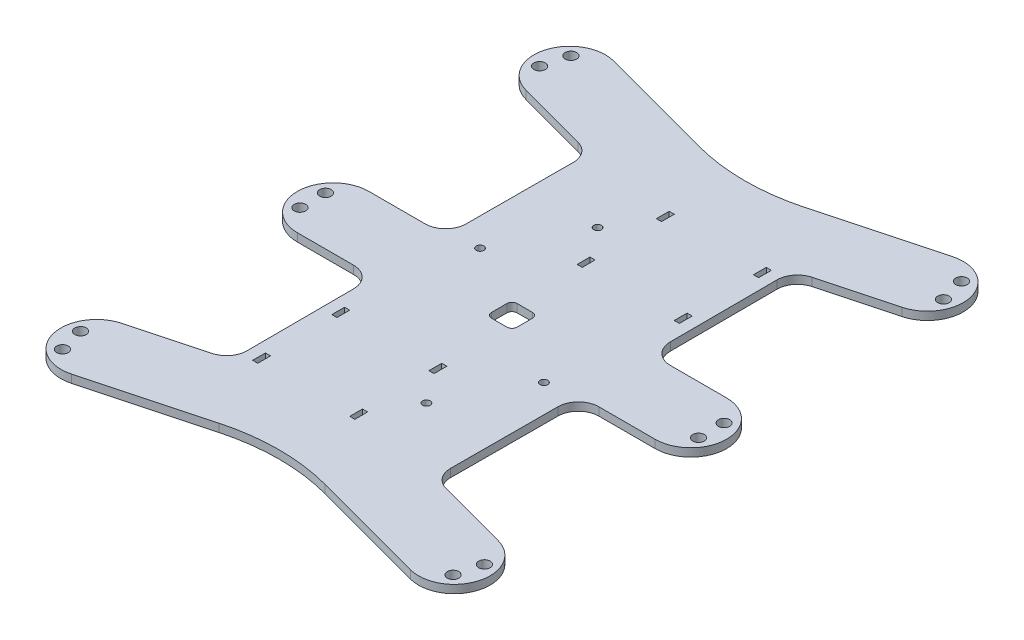
from build123d import *

# Parameters (mm, degrees)
BOSS_EXTRUDE1_DEPTH = 3.175
FILLET1_R           = 80
FILLET2_R           = 8
SKETCH7_R           = 2.25
CUT_EXTRUDE4_DEPTH  = 10
CUT_EXTRUDE5_DEPTH  = 10
SKETCH9_W           = 10
SKETCH9_H           = 10
CUT_EXTRUDE6_DEPTH  = 10
FILLET3_R           = 2
SKETCH12_W          = 2
SKETCH12_H          = 5
CUT_EXTRUDE7_DEPTH  = 10


with BuildPart() as part:
    # Sketch1 → Boss-Extrude1 (new body)
    with BuildSketch(Plane(origin=(0, 0, 0), x_dir=(1, 0, 0), z_dir=(0, 1, 0))):
        with BuildLine():
            Line((-70, 14), (-40, 14))
            Line((-40, 14), (-39.816062711, 70))
            Line((-39.816062711, 70), (-73.623466631, 79.058666579))
            ThreePointArc((-73.623466631, 79.058666579), (-83.522961568, 96.205094778), (-66.376533369, 106.104589715))
            Line((-66.376533369, 106.104589715), (0, 88.319051202))
            Line((0, 88.319051202), (66.376533369, 106.104589715))
            ThreePointArc((66.376533369, 106.104589715), (83.522961568, 96.205094778), (73.623466631, 79.058666579))
            Line((73.623466631, 79.058666579), (39.816062711, 70))
            Line((39.816062711, 70), (40, 14))
            Line((40, 14), (70, 14))
            ThreePointArc((70, 14), (84, 0), (70, -14))
            Line((70, -14), (40, -14))
            Line((40, -14), (39.816062711, -70))
            Line((39.816062711, -70), (73.623466631, -79.058666579))
            ThreePointArc((73.623466631, -79.058666579), (83.522961568, -96.205094778), (66.376533369, -106.104589715))
            Line((66.376533369, -106.104589715), (0, -88.319051202))
            Line((0, -88.319051202), (-66.376533369, -106.104589715))
            ThreePointArc((-66.376533369, -106.104589715), (-83.522961568, -96.205094778), (-73.623466631, -79.058666579))
            Line((-73.623466631, -79.058666579), (-39.816062711, -70))
            Line((-39.816062711, -70), (-40, -14))
            Line((-40, -14), (-70, -14))
            ThreePointArc((-70, -14), (-84, 0), (-70, 14))
        make_face()
    extrude(amount=BOSS_EXTRUDE1_DEPTH)

    # Fillet1
    fillet1_edges = [part.edges().sort_by_distance(p)[0] for p in [
        (0, 1.5875, -88.319051202),
        (0, 1.5875, 88.319051202),
    ]]
    fillet(fillet1_edges, radius=FILLET1_R)

    # Fillet2
    fillet2_edges = [part.edges().sort_by_distance(p)[0] for p in [
        (-40, 1.5875, -14),
        (-39.816062711, 1.5875, -70),
        (39.816062711, 1.5875, -70),
        (40, 1.5875, -14),
        (40, 1.5875, 14),
        (39.816062711, 1.5875, 70),
        (-39.816062711, 1.5875, 70),
        (-40, 1.5875, 14),
    ]]
    fillet(fillet2_edges, radius=FILLET2_R)

    # Sketch7 → Cut-Extrude4 (cut)
    with BuildSketch(Plane(origin=(0, 3.175, 0), x_dir=(1, 0, 0), z_dir=(0, 1, 0))):
        with Locations(Location((-76.433311385, -99.481809639, 0), (0, 0, 270))):
            Circle(SKETCH7_R)
        with Locations(Location((-79.021501836, -89.822551376, 0), (0, 0, 270))):
            Circle(SKETCH7_R)
        with Locations(Location((-78, -5, 0), (0, 0, 270))):
            Circle(SKETCH7_R)
        with Locations(Location((-78, 5, 0), (0, 0, 270))):
            Circle(SKETCH7_R)
        with Locations(Location((-79.021501836, 89.822551376, 0), (0, 0, 270))):
            Circle(SKETCH7_R)
        with Locations(Location((-76.433311385, 99.481809639, 0), (0, 0, 270))):
            Circle(SKETCH7_R)
        with Locations(Location((79.021501836, 89.822551376, 0), (0, 0, 270))):
            Circle(SKETCH7_R)
        with Locations(Location((76.433311385, 99.481809639, 0), (0, 0, 270))):
            Circle(SKETCH7_R)
        with Locations(Location((78, -5, 0), (0, 0, 270))):
            Circle(SKETCH7_R)
        with Locations(Location((78, 5, 0), (0, 0, 270))):
            Circle(SKETCH7_R)
        with Locations(Location((79.021501836, -89.822551376, 0), (0, 0, 270))):
            Circle(SKETCH7_R)
        with Locations(Location((76.433311385, -99.481809639, 0), (0, 0, 270))):
            Circle(SKETCH7_R)
    extrude(amount=-CUT_EXTRUDE4_DEPTH, mode=Mode.SUBTRACT)

    # Sketch8 → Cut-Extrude5 (cut)
    with BuildSketch(Plane(origin=(0, 3.175, 0), x_dir=(1, 0, 0), z_dir=(0, 1, 0))):
        with BuildLine():
            ThreePointArc((13, -45), (11.5, -46.5), (13, -48))
            ThreePointArc((13, -48), (14.5, -46.5), (13, -45))
        make_face()
        with BuildLine():
            ThreePointArc((29, -15), (27.5, -16.5), (29, -18))
            ThreePointArc((29, -18), (30.5, -16.5), (29, -15))
        make_face()
        with BuildLine():
            ThreePointArc((-13, 48), (-14.5, 46.5), (-13, 45))
            ThreePointArc((-13, 45), (-11.5, 46.5), (-13, 48))
        make_face()
        with BuildLine():
            ThreePointArc((-29, 18), (-30.5, 16.5), (-29, 15))
            ThreePointArc((-29, 15), (-27.5, 16.5), (-29, 18))
        make_face()
    extrude(amount=-CUT_EXTRUDE5_DEPTH, mode=Mode.SUBTRACT)

    # Sketch9 → Cut-Extrude6 (cut)
    with BuildSketch(Plane(origin=(0, 3.175, 0), x_dir=(1, 0, 0), z_dir=(0, 1, 0))):
        Rectangle(SKETCH9_W, SKETCH9_H)
    extrude(amount=-CUT_EXTRUDE6_DEPTH, mode=Mode.SUBTRACT)

    # Fillet3
    fillet3_edges = [part.edges().sort_by_distance(p)[0] for p in [
        (-5, 1.5875, 5),
        (-5, 1.5875, -5),
        (5, 1.5875, -5),
        (5, 1.5875, 5),
    ]]
    fillet(fillet3_edges, radius=FILLET3_R)

    # Sketch12 → Cut-Extrude7 (cut)
    with BuildSketch(Plane(origin=(0, 3.175, 0), x_dir=(1, 0, 0), z_dir=(0, 1, 0))):
        with Locations((-34.5, -32.5)):
            Rectangle(SKETCH12_W, SKETCH12_H)
        with Locations((-34.5, -63.5)):
            Rectangle(SKETCH12_W, SKETCH12_H)
        with Locations((3.5, -63.5)):
            Rectangle(SKETCH12_W, SKETCH12_H)
        with Locations((3.5, -32.5)):
            Rectangle(SKETCH12_W, SKETCH12_H)
        with Locations((-3.5, 63.5)):
            Rectangle(SKETCH12_W, SKETCH12_H)
        with Locations((-3.5, 32.5)):
            Rectangle(SKETCH12_W, SKETCH12_H)
        with Locations((34.5, 32.5)):
            Rectangle(SKETCH12_W, SKETCH12_H)
        with Locations((34.5, 63.5)):
            Rectangle(SKETCH12_W, SKETCH12_H)
    extrude(amount=-CUT_EXTRUDE7_DEPTH, mode=Mode.SUBTRACT)


solid = part.part
